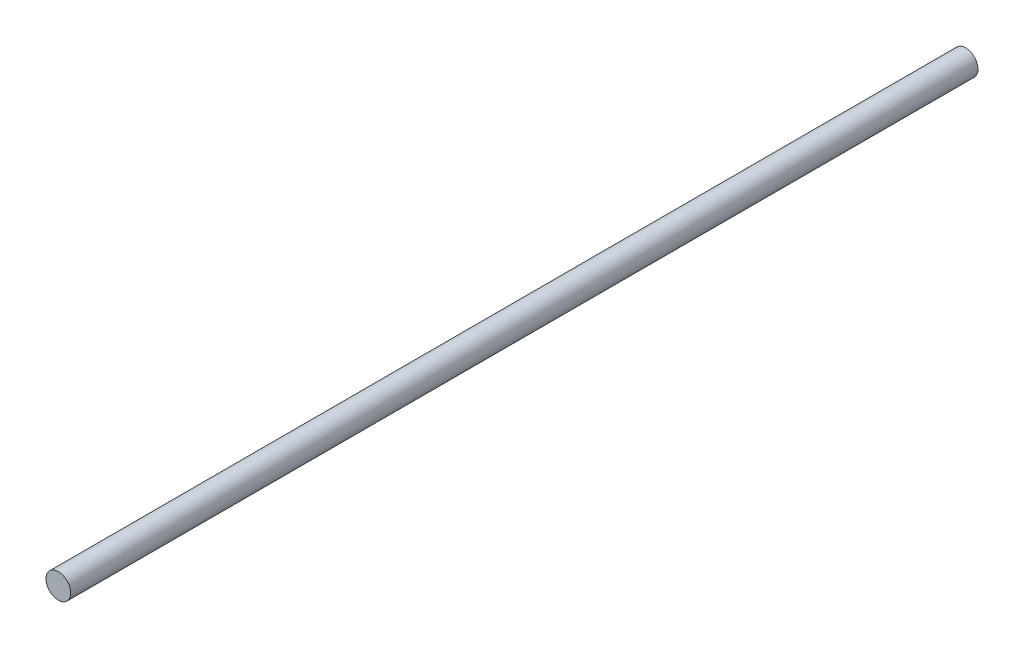
from build123d import *

# Parameters (mm, degrees)
CROQUIS1_R              = 1.5
SALIENTE_EXTRUIR1_DEPTH = 110


with BuildPart() as part:
    # Croquis1 → Saliente-Extruir1 (new body)
    with BuildSketch(Plane.XY):
        Circle(CROQUIS1_R)
    extrude(amount=-SALIENTE_EXTRUIR1_DEPTH)


solid = part.part
